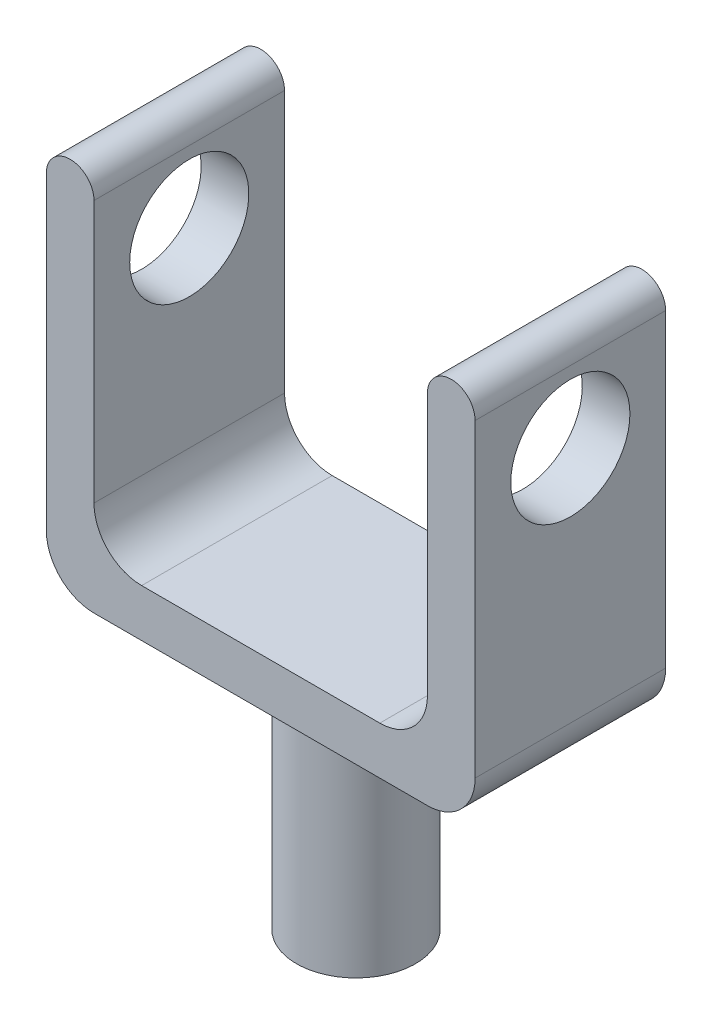
from build123d import *

# Parameters (mm, degrees)
BOSS_EXTRUDE1_DEPTH = 400
SKETCH3_R           = 125
BOSS_EXTRUDE2_DEPTH = 500
FILLET1_R           = 100
SKETCH5_R           = 125
CUT_EXTRUDE1_DEPTH  = 2046


with BuildPart() as part:
    # Sketch1 → Boss-Extrude1 (new body)
    with BuildSketch(Plane.XY):
        with BuildLine():
            Line((15.274151436, 50), (15.274151436, 700))
            ThreePointArc((15.274151436, 700), (65.274151436, 750), (115.274151436, 700))
            Line((115.274151436, 700), (115.274151436, -50))
            Line((115.274151436, -50), (-784.725848564, -50))
            Line((-784.725848564, -50), (-784.725848564, 700))
            ThreePointArc((-784.725848564, 700), (-734.725848564, 750), (-684.725848564, 700))
            Line((-684.725848564, 700), (-684.725848564, 50))
            Line((-684.725848564, 50), (15.274151436, 50))
        make_face()
    extrude(amount=BOSS_EXTRUDE1_DEPTH)

    # Sketch3 → Boss-Extrude2 (add)
    with BuildSketch(Plane.XZ.offset(50)):
        with Locations(Location((-334.725848564, 200, 0), (0, 0, 270))):
            Circle(SKETCH3_R)
    extrude(amount=BOSS_EXTRUDE2_DEPTH)

    # Fillet1
    fillet1_edges = [part.edges().sort_by_distance(p)[0] for p in [
        (15.274151436, 50, 200),
        (115.274151436, -50, 200),
        (-784.725848564, -50, 200),
        (-684.725848564, 50, 200),
    ]]
    fillet(fillet1_edges, radius=FILLET1_R)

    # Sketch5 → Cut-Extrude1 (cut)
    with BuildSketch(Plane.ZY.offset(784.725848564)):
        with Locations(Location((200, 550, 0), (0, 0, 90))):
            Circle(SKETCH5_R)
    extrude(amount=-CUT_EXTRUDE1_DEPTH, mode=Mode.SUBTRACT)


solid = part.part
